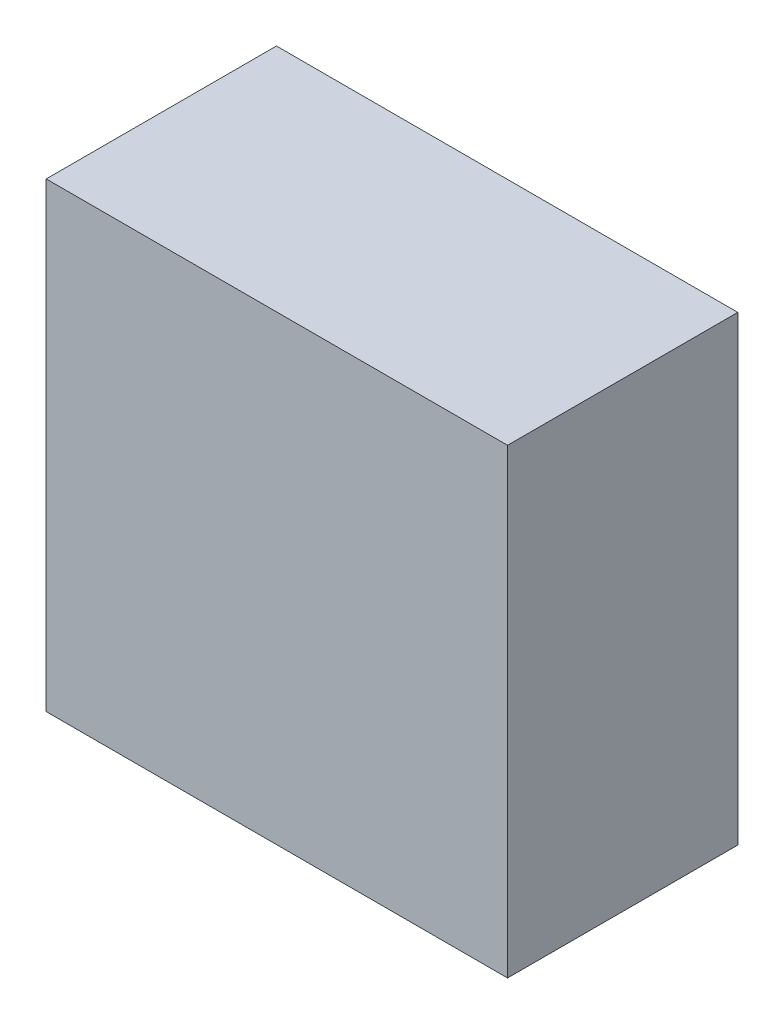
from build123d import *

# Parameters (mm, degrees)
SKETCH1_W           = 100.2
SKETCH1_H           = 100.2
BOSS_EXTRUDE1_DEPTH = 50


with BuildPart() as part:
    # Sketch1 → Boss-Extrude1 (new body)
    with BuildSketch(Plane.XY):
        Rectangle(SKETCH1_W, SKETCH1_H)
    extrude(amount=-BOSS_EXTRUDE1_DEPTH)


solid = part.part
